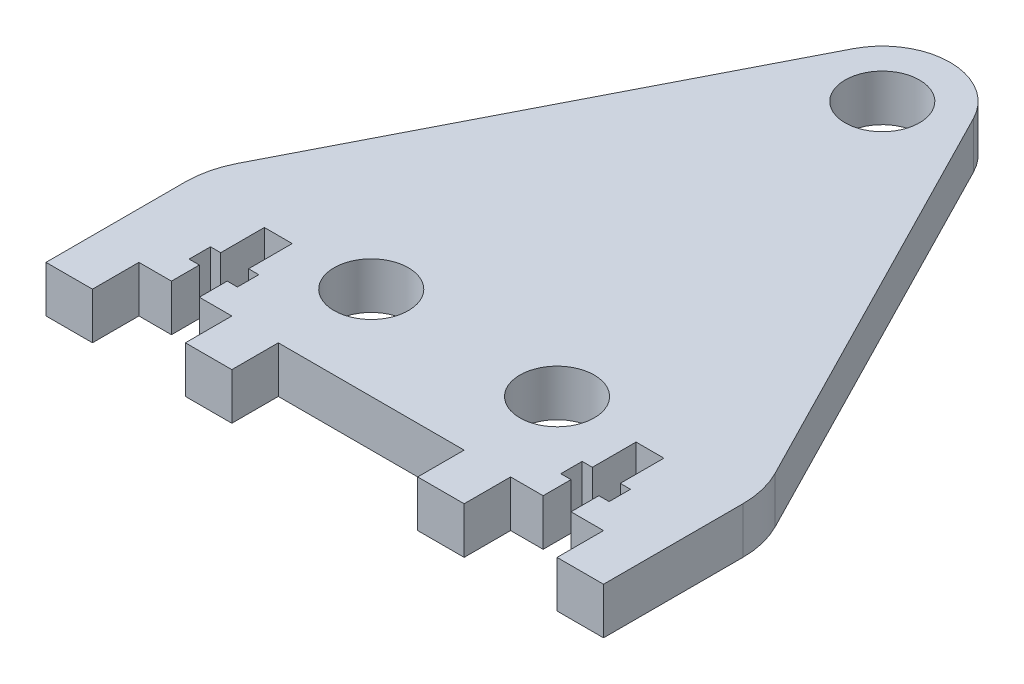
from build123d import *

# Parameters (mm, degrees)
SKETCH1_R           = 4
BOSS_EXTRUDE1_DEPTH = 5


with BuildPart() as part:
    # Sketch1 → Boss-Extrude1 (new body)
    with BuildSketch(Plane(origin=(0, 0, 0), x_dir=(1, 0, 0), z_dir=(0, 1, 0))):
        with BuildLine():
            Line((-30, 10), (-30, -5))
            Line((-30, -5), (-25, -5))
            Line((-25, -5), (-25, 0))
            Line((-25, 0), (-21.5, 0))
            Line((-21.5, 0), (-21.5, 3))
            Line((-21.5, 3), (-22.6, 3))
            Line((-22.6, 3), (-22.6, 5.3))
            Line((-22.6, 5.3), (-21.5, 5.3))
            Line((-21.5, 5.3), (-21.5, 10))
            Line((-21.5, 10), (-18.5, 10))
            Line((-18.5, 10), (-18.5, 5.3))
            Line((-18.5, 5.3), (-17.4, 5.3))
            Line((-17.4, 5.3), (-17.4, 3))
            Line((-17.4, 3), (-18.5, 3))
            Line((-18.5, 3), (-18.5, 0))
            Line((-18.5, 0), (-15, 0))
            Line((-15, 0), (-15, -5))
            Line((-15, -5), (-10, -5))
            Line((-10, -5), (-10, 0))
            Line((-10, 0), (10, 0))
            Line((10, 0), (10, -5))
            Line((10, -5), (15, -5))
            Line((15, -5), (15, 0))
            Line((15, 0), (18.5, 0))
            Line((18.5, 0), (18.5, 3))
            Line((18.5, 3), (17.4, 3))
            Line((17.4, 3), (17.4, 5.3))
            Line((17.4, 5.3), (18.5, 5.3))
            Line((18.5, 5.3), (18.5, 10))
            Line((18.5, 10), (21.5, 10))
            Line((21.5, 10), (21.5, 5.3))
            Line((21.5, 5.3), (22.6, 5.3))
            Line((22.6, 5.3), (22.6, 3))
            Line((22.6, 3), (21.5, 3))
            Line((21.5, 3), (21.5, 0))
            Line((21.5, 0), (25, 0))
            Line((25, 0), (25, -5))
            Line((25, -5), (30, -5))
            Line((30, -5), (30, 10))
            ThreePointArc((30, 10), (29.721396184, 12.344025646), (28.901108754, 14.557440395))
            Line((28.901108754, 14.557440395), (6.492233497, 58.324076585))
            ThreePointArc((6.492233497, 58.324076585), (0, 62.293735732), (-6.492233497, 58.324076585))
            Line((-6.492233497, 58.324076585), (-28.901108754, 14.557440395))
            ThreePointArc((-28.901108754, 14.557440395), (-29.721396184, 12.344025646), (-30, 10))
        make_face()
        with Locations(Location((0, 55, 0), (0, 0, 90))):
            Circle(SKETCH1_R, mode=Mode.SUBTRACT)
        with Locations(Location((-10, 10, 0), (0, 0, 270))):
            Circle(SKETCH1_R, mode=Mode.SUBTRACT)
        with Locations(Location((10, 10, 0), (0, 0, 90))):
            Circle(SKETCH1_R, mode=Mode.SUBTRACT)
    extrude(amount=BOSS_EXTRUDE1_DEPTH)


solid = part.part
